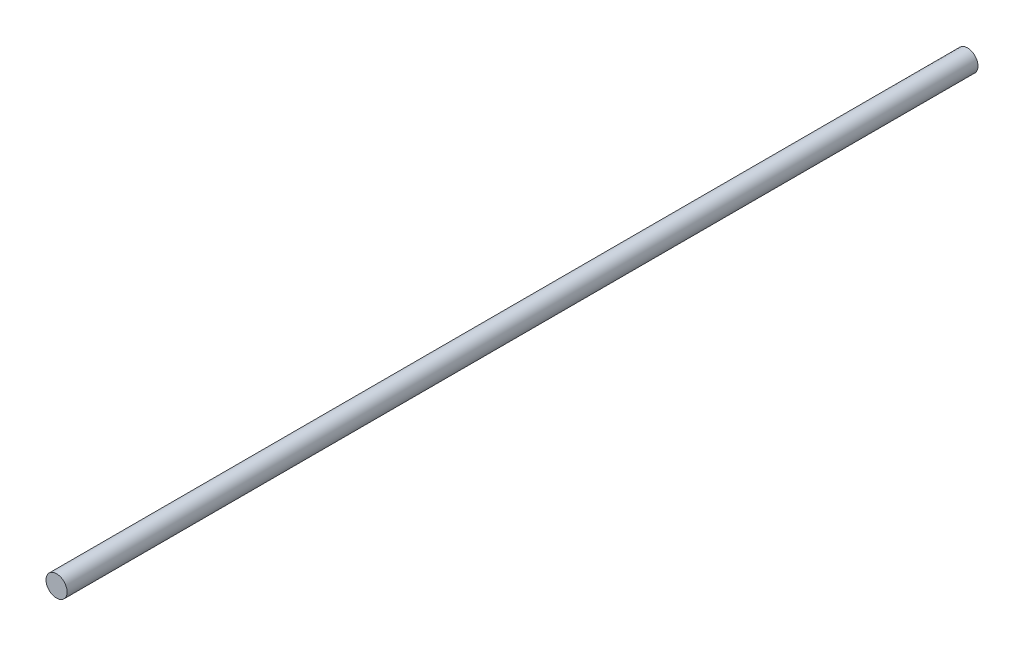
from build123d import *

# Parameters (mm, degrees)
SKETCH1_R           = 4
BOSS_EXTRUDE1_DEPTH = 345


with BuildPart() as part:
    # Sketch1 → Boss-Extrude1 (new body)
    with BuildSketch(Plane.XY):
        Circle(SKETCH1_R)
    extrude(amount=BOSS_EXTRUDE1_DEPTH)


solid = part.part
